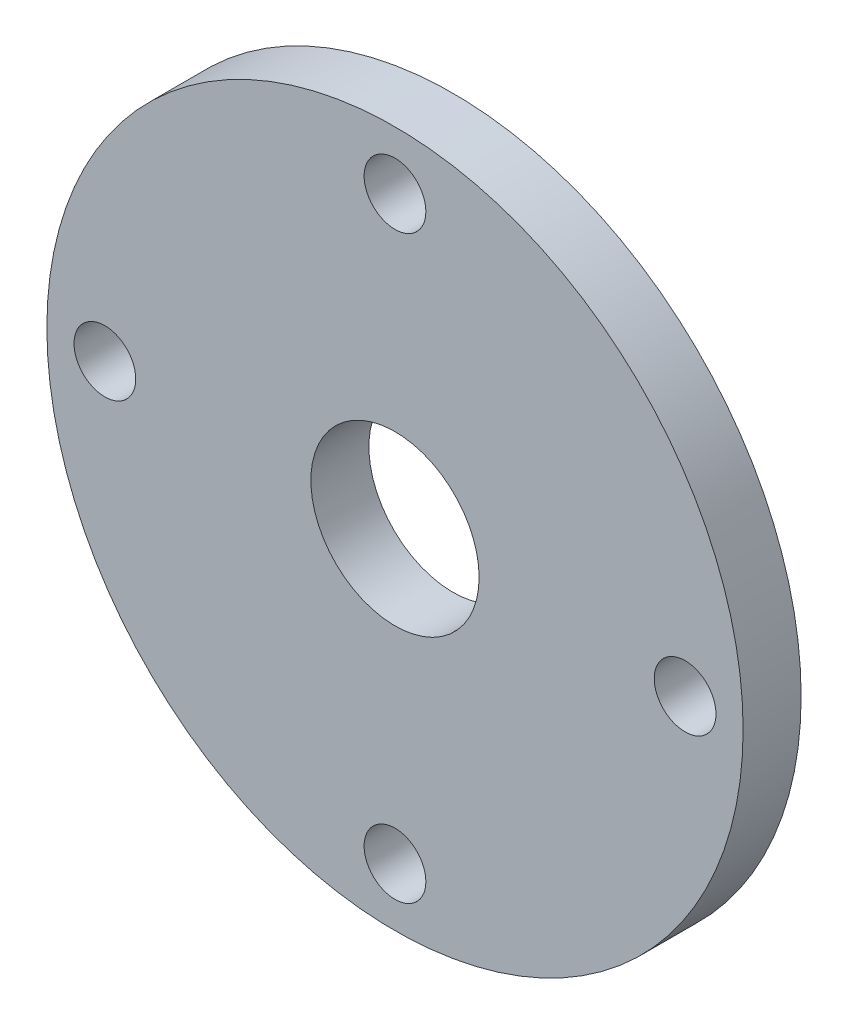
from build123d import *

# Parameters (mm, degrees)
SKETCH1_R           = 38.1
BOSS_EXTRUDE1_DEPTH = 6.35
SKETCH2_R           = 3.3782
CUT_EXTRUDE1_DEPTH  = 6.35
SKETCH3_R           = 9.2075
CUT_EXTRUDE2_DEPTH  = 6.35


with BuildPart() as part:
    # Sketch1 → Boss-Extrude1 (new body)
    with BuildSketch(Plane.XY):
        Circle(SKETCH1_R)
    extrude(amount=BOSS_EXTRUDE1_DEPTH)

    # Sketch2 → Cut-Extrude1 (cut)
    with BuildSketch(Plane.XY.offset(6.35)):
        with Locations((0, 31.75)):
            Circle(SKETCH2_R)
        with Locations((31.75, 0)):
            Circle(SKETCH2_R)
        with Locations((0, -31.75)):
            Circle(SKETCH2_R)
        with Locations((-31.75, 0)):
            Circle(SKETCH2_R)
    extrude(amount=-CUT_EXTRUDE1_DEPTH, mode=Mode.SUBTRACT)

    # Sketch3 → Cut-Extrude2 (cut)
    with BuildSketch(Plane.XY.offset(6.35)):
        Circle(SKETCH3_R)
    extrude(amount=-CUT_EXTRUDE2_DEPTH, mode=Mode.SUBTRACT)


solid = part.part
